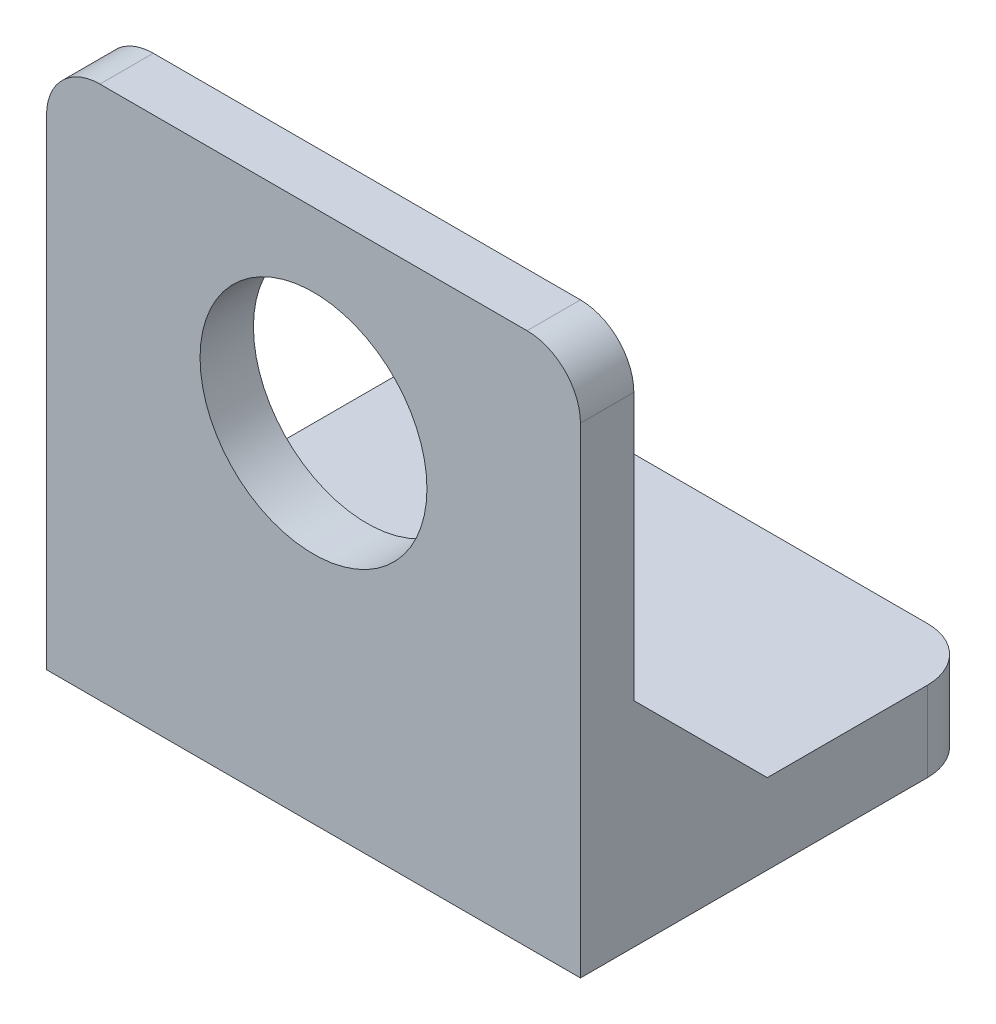
from build123d import *

# Parameters (mm, degrees)
SKICA1_W                = 20
SKICA1_H                = 20
SKICA1_R                = 4.25
P_IDAT_VYSUNUT_M1_DEPTH = 2
P_IDAT_START            = -2
SKICA2_W                = 20
SKICA2_H                = 3
P_IDAT_VYSUNUT_M2_DEPTH = 15
P_IDAT_VYSUNUT_M3_DEPTH = 2
ZAOBLIT1_R              = 2
ZAOBLIT2_R              = 2


with BuildPart() as part:
    # Skica1 → Přidat vysunutím1 (new body)
    with BuildSketch(Plane.XY):
        with Locations((0, -3)):
            Rectangle(SKICA1_W, SKICA1_H)
        Circle(SKICA1_R, mode=Mode.SUBTRACT)
    extrude(amount=-P_IDAT_VYSUNUT_M1_DEPTH)

    # Skica2 → Přidat vysunutím2 (add)
    with BuildSketch(Plane(origin=(0, 0, -2), x_dir=(-1, 0, 0), z_dir=(0, 0, -1)).offset(P_IDAT_START)):
        with Locations((0, -11.5)):
            Rectangle(SKICA2_W, SKICA2_H)
    extrude(amount=P_IDAT_VYSUNUT_M2_DEPTH)

    # Skica3 → Přidat vysunutím3 (add)
    with BuildSketch(Plane.ZY.offset(10)):
        Polygon((-2, -10), (-7, -10), (-2, -5), align=None)
    p_idat_vysunut_m3 = extrude(amount=-P_IDAT_VYSUNUT_M3_DEPTH)

    # Zrcadlit1: Přidat vysunutím3 across plane
    add(p_idat_vysunut_m3.mirror(Plane(origin=(0, 0, 0), x_dir=(0, 0, 1), z_dir=(1, 0, 0))))

    # Zaoblit1
    zaoblit1_edges = [part.edges().sort_by_distance(p)[0] for p in [
        (-10, 7, -1),
        (10, 7, -1),
    ]]
    fillet(zaoblit1_edges, radius=ZAOBLIT1_R)

    # Zaoblit2
    zaoblit2_edges = [part.edges().sort_by_distance(p)[0] for p in [
        (-10, -11.5, -15),
        (10, -11.5, -15),
    ]]
    fillet(zaoblit2_edges, radius=ZAOBLIT2_R)


solid = part.part
